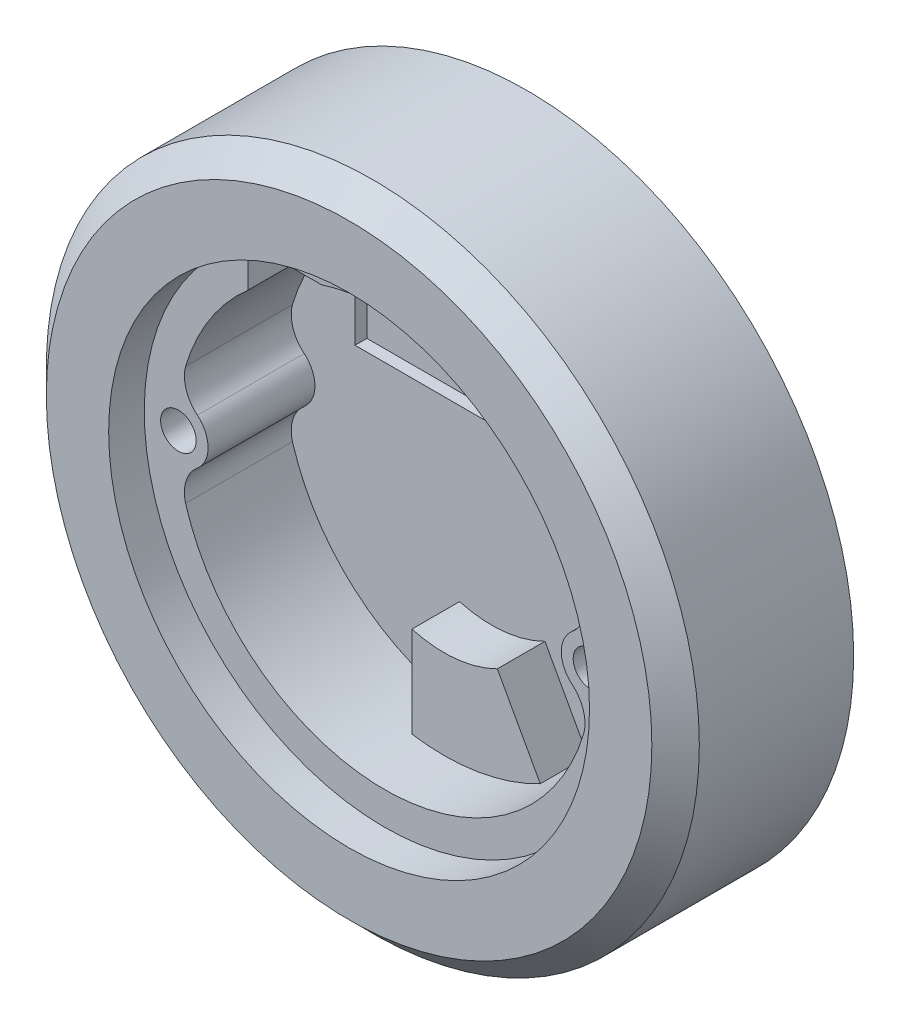
from build123d import *

# Parameters (mm, degrees)
SKETCH1_R                = 27.5
BOSS_EXTRUDE1_DEPTH      = 15
CHAMFER1_SIZE            = 2
SKETCH2_R                = 17.5
CUT_EXTRUDE1_DEPTH       = 12
SKETCH3_R                = 20.25
CUT_EXTRUDE2_DEPTH       = 3
SKETCH4_R                = 2
CUT_EXTRUDE3_DEPTH       = 42.683330001
BOSS_EXTRUDE2_DEPTH      = 9
SKETCH6_R                = 1.5
CUT_EXTRUDE4_DEPTH       = 41.700123015
CHAMFER2_SIZE            = 2
CHAMFER2_OF_MIRROR1_SIZE = 2
BOSS_EXTRUDE8_START      = 4.01
BOSS_EXTRUDE8_DEPTH      = 4.01
SKETCH14_W               = 23
SKETCH14_H               = 12
CUT_EXTRUDE5_DEPTH       = 10


with BuildPart() as part:
    # Sketch1 → Boss-Extrude1 (new body)
    with BuildSketch(Plane.XY):
        Circle(SKETCH1_R)
    extrude(amount=BOSS_EXTRUDE1_DEPTH)

    # Chamfer1
    chamfer1_edges = [part.edges().sort_by_distance(p)[0] for p in [
        (-27.5, 0, 15),
    ]]
    chamfer(chamfer1_edges, length=CHAMFER1_SIZE)

    # Sketch2 → Cut-Extrude1 (cut)
    with BuildSketch(Plane.XY.offset(15)):
        Circle(SKETCH2_R)
    extrude(amount=-CUT_EXTRUDE1_DEPTH, mode=Mode.SUBTRACT)

    # Sketch3 → Cut-Extrude2 (cut)
    with BuildSketch(Plane.XY.offset(15)):
        Circle(SKETCH3_R)
    extrude(amount=-CUT_EXTRUDE2_DEPTH, mode=Mode.SUBTRACT)

    # Sketch4 → Cut-Extrude3 (cut, through all)
    with BuildSketch(Plane(origin=(0, 0, 0), x_dir=(1, 0, 0), z_dir=(0, 1, 0))):
        with Locations(Location((0, -5, 0), (0, 0, 270))):
            Circle(SKETCH4_R)
    extrude(amount=-CUT_EXTRUDE3_DEPTH, mode=Mode.SUBTRACT)

    # Sketch5 → Boss-Extrude2 (add)
    with BuildSketch(Plane.XY.offset(12)):
        with BuildLine():
            ThreePointArc((-15.781356255, -1.926213803), (-14.875, 0), (-15.781356255, 1.926213803))
            ThreePointArc((-15.781356255, 1.926213803), (-16.724757779, 3.318673761), (-16.770509831, 5))
            ThreePointArc((-16.770509831, 5), (-17.5, 0), (-16.770509831, -5))
            ThreePointArc((-16.770509831, -5), (-16.724757779, -3.318673761), (-15.781356255, -1.926213803))
        make_face()
    boss_extrude2 = extrude(amount=-BOSS_EXTRUDE2_DEPTH)

    # Sketch6 → Cut-Extrude4 (cut, through all)
    with BuildSketch(Plane.XY.offset(12)):
        with Locations((-17.375, 0)):
            Circle(SKETCH6_R)
    cut_extrude4 = extrude(amount=-CUT_EXTRUDE4_DEPTH, mode=Mode.SUBTRACT)

    # Chamfer2
    chamfer2_edges = [part.edges().sort_by_distance(p)[0] for p in [
        (-18.875, 0, 0),
    ]]
    chamfer(chamfer2_edges, length=CHAMFER2_SIZE)

    # Mirror1: Boss-Extrude2, Cut-Extrude4 across plane
    add(boss_extrude2.mirror(Plane(origin=(0, 0, 0), x_dir=(0, 0, 1), z_dir=(1, 0, 0))))
    add(cut_extrude4.mirror(Plane(origin=(0, 0, 0), x_dir=(0, 0, 1), z_dir=(1, 0, 0))), mode=Mode.SUBTRACT)

    # Chamfer2 of Mirror1
    chamfer2_of_mirror1_edges = [part.edges().sort_by_distance(p)[0] for p in [
        (18.875, 0, 0),
    ]]
    chamfer(chamfer2_of_mirror1_edges, length=CHAMFER2_OF_MIRROR1_SIZE)

    # Sketch8 → Boss-Extrude8 (add)
    with BuildSketch(Plane.XY.offset(3).offset(BOSS_EXTRUDE8_START)):
        with BuildLine():
            Line((-2.696676707, -17.29097842), (-2.696676707, -9.629534503))
            ThreePointArc((-2.696676707, -9.629534503), (0.96452096, -9.953376277), (4.495419158, -8.932592378))
            Line((4.495419158, -8.932592378), (8.114072505, -15.505219359))
            ThreePointArc((8.114072505, -15.505219359), (2.852065596, -17.266027969), (-2.696676707, -17.29097842))
        make_face()
    extrude(amount=-BOSS_EXTRUDE8_DEPTH)

    # Sketch14 → Cut-Extrude5 (cut)
    with BuildSketch(Plane.XY.offset(12)):
        with Locations((0, 10.667708301)):
            Rectangle(SKETCH14_W, SKETCH14_H)
    extrude(amount=-CUT_EXTRUDE5_DEPTH, mode=Mode.SUBTRACT)


solid = part.part
